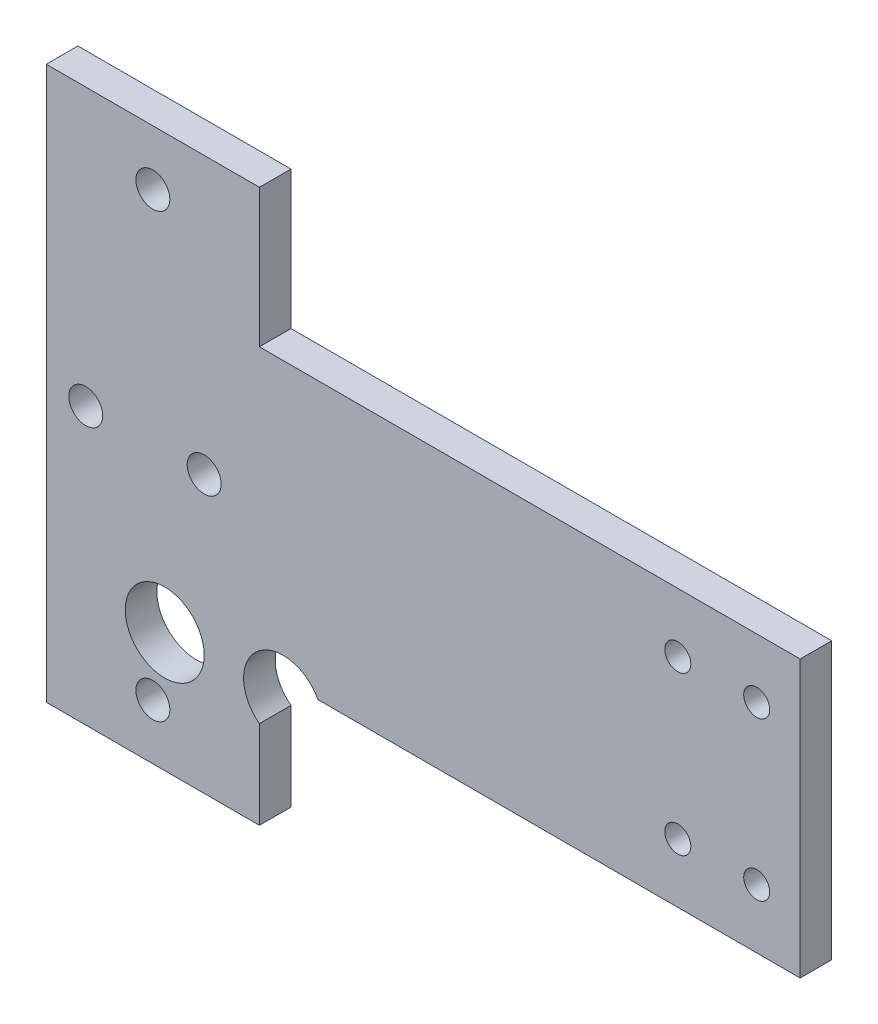
from build123d import *

# Parameters (mm, degrees)
SKETCH_1_W          = 100
SKETCH_1_H          = 35
EXTRUDE_1_DEPTH     = 4
SKETCH_2_R          = 1.65
CUT_EXTRUDE_1_DEPTH = 107.023582282
SKETCH_4_R          = 2.15
CUT_EXTRUDE_3_DEPTH = 107.023582282
SKETCH_8_W          = 27
SKETCH_8_H          = 70
SKETCH_8_R          = 2.15
EXTRUDE_2_DEPTH     = 4
SKETCH_9_R          = 5
CUT_EXTRUDE_6_DEPTH = 4
SKETCH_10_R         = 1.65
CUT_EXTRUDE_7_DEPTH = 10
SKETCH_11_W         = 4.5
SKETCH_11_H         = 35
CUT_EXTRUDE_8_DEPTH = 10


with BuildPart() as part:
    # 草图1 → 凸台-拉伸1 (new body)
    with BuildSketch(Plane.XY):
        with Locations((50, -17.5)):
            Rectangle(SKETCH_1_W, SKETCH_1_H)
    extrude(amount=EXTRUDE_1_DEPTH)

    # 草图2 → 切除-拉伸1 (cut, through all)
    with BuildSketch(Plane.XY.offset(4)):
        with Locations((80, -7.5)):
            Circle(SKETCH_2_R)
        with Locations(Location((80, -27.5, 0), (0, 0, 180))):
            Circle(SKETCH_2_R)
    extrude(amount=-CUT_EXTRUDE_1_DEPTH, mode=Mode.SUBTRACT)

    # 草图4 → 切除-拉伸3 (cut, through all)
    with BuildSketch(Plane.XY.offset(4)):
        with Locations((5, -17.5)):
            Circle(SKETCH_4_R)
        with Locations((20, -17.5)):
            Circle(SKETCH_4_R)
    extrude(amount=-CUT_EXTRUDE_3_DEPTH, mode=Mode.SUBTRACT)

    # 草图8 → 凸台-拉伸2 (add)
    with BuildSketch(Plane.XY.offset(4)):
        with Locations((13.5, -17.5)):
            Rectangle(SKETCH_8_W, SKETCH_8_H)
        with Locations((13.5, 10.5)):
            Circle(SKETCH_8_R, mode=Mode.SUBTRACT)
        with Locations(Location((13.5, -45.5, 0), (0, 0, 180))):
            Circle(SKETCH_8_R, mode=Mode.SUBTRACT)
        with Locations((5, -17.5)):
            Circle(SKETCH_8_R, mode=Mode.SUBTRACT)
        with Locations((20, -17.5)):
            Circle(SKETCH_8_R, mode=Mode.SUBTRACT)
    extrude(amount=-EXTRUDE_2_DEPTH)

    # 草图9 → 切除-拉伸6 (cut)
    with BuildSketch(Plane.XY.offset(4)):
        with Locations((30, -37.34)):
            Circle(SKETCH_9_R)
        with Locations((15, -37.34)):
            Circle(SKETCH_9_R)
    extrude(amount=-CUT_EXTRUDE_6_DEPTH, mode=Mode.SUBTRACT)

    # 草图10 → 切除-拉伸7 (cut)
    with BuildSketch(Plane.XY.offset(4)):
        with Locations((90, -7.5)):
            Circle(SKETCH_10_R)
        with Locations((90, -27.5)):
            Circle(SKETCH_10_R)
    extrude(amount=-CUT_EXTRUDE_7_DEPTH, mode=Mode.SUBTRACT)

    # 草图11 → 切除-拉伸8 (cut)
    with BuildSketch(Plane.XY.offset(4)):
        with Locations((97.75, -17.5)):
            Rectangle(SKETCH_11_W, SKETCH_11_H)
    extrude(amount=-CUT_EXTRUDE_8_DEPTH, mode=Mode.SUBTRACT)


solid = part.part
